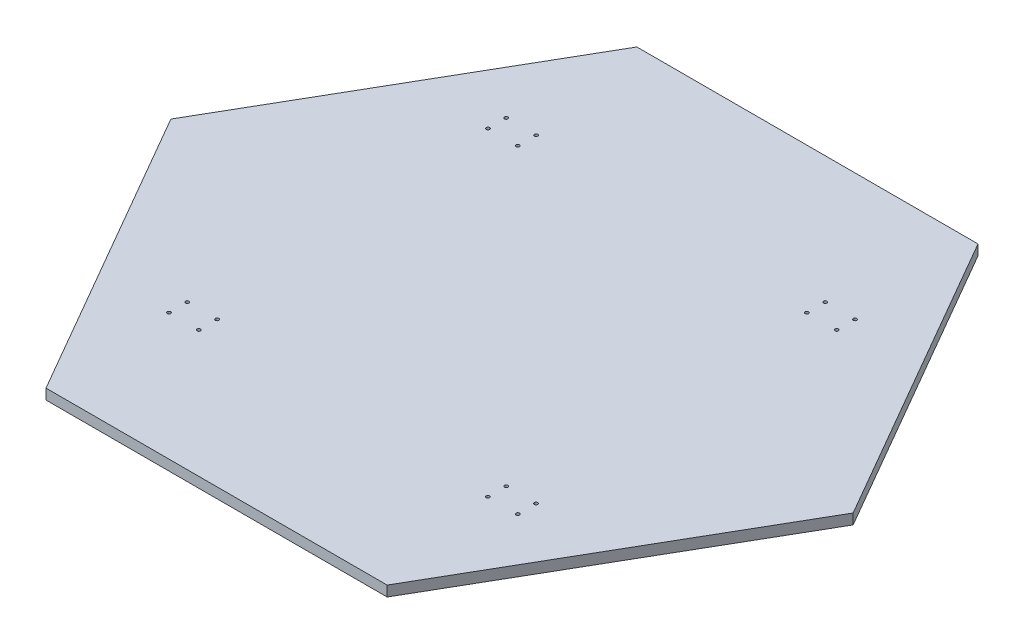
from build123d import *

# Parameters (mm, degrees)
BOSS_EXTRUDE1_DEPTH = 25.4
SKETCH5_R           = 4.191
CUT_EXTRUDE1_DEPTH  = 25.4


with BuildPart() as part:
    # Sketch1 → Boss-Extrude1 (new body)
    with BuildSketch(Plane(origin=(0, 0, 0), x_dir=(1, 0, 0), z_dir=(0, 1, 0))):
        Polygon((835.323484187, 0), (417.661742094, 723.411357684), (-417.661742094, 723.411357684), (-835.323484187, 0), (-417.661742094, -723.411357684), (417.661742094, -723.411357684), align=None)
    extrude(amount=BOSS_EXTRUDE1_DEPTH)

    # Sketch5 → Cut-Extrude1 (cut)
    with BuildSketch(Plane(origin=(0, 25.4, 0), x_dir=(1, 0, 0), z_dir=(0, 1, 0))):
        with Locations(Location((-353.949, 412.877, 0), (0, 0, 270))):
            Circle(SKETCH5_R)
        with Locations(Location((-427.101, 412.877, 0), (0, 0, 270))):
            Circle(SKETCH5_R)
        with Locations(Location((-427.101, 368.173, 0), (0, 0, 270))):
            Circle(SKETCH5_R)
        with Locations(Location((-353.949, 368.173, 0), (0, 0, 270))):
            Circle(SKETCH5_R)
        with Locations(Location((353.949, 368.173, 0), (0, 0, 270))):
            Circle(SKETCH5_R)
        with Locations(Location((427.101, 368.173, 0), (0, 0, 270))):
            Circle(SKETCH5_R)
        with Locations(Location((427.101, 412.877, 0), (0, 0, 270))):
            Circle(SKETCH5_R)
        with Locations(Location((353.949, 412.877, 0), (0, 0, 270))):
            Circle(SKETCH5_R)
        with Locations(Location((353.949, -412.877, 0), (0, 0, 270))):
            Circle(SKETCH5_R)
        with Locations(Location((427.101, -412.877, 0), (0, 0, 270))):
            Circle(SKETCH5_R)
        with Locations(Location((427.101, -368.173, 0), (0, 0, 270))):
            Circle(SKETCH5_R)
        with Locations(Location((353.949, -368.173, 0), (0, 0, 270))):
            Circle(SKETCH5_R)
        with Locations(Location((-353.949, -368.173, 0), (0, 0, 270))):
            Circle(SKETCH5_R)
        with Locations(Location((-427.101, -368.173, 0), (0, 0, 270))):
            Circle(SKETCH5_R)
        with Locations(Location((-427.101, -412.877, 0), (0, 0, 270))):
            Circle(SKETCH5_R)
        with Locations(Location((-353.949, -412.877, 0), (0, 0, 270))):
            Circle(SKETCH5_R)
    extrude(amount=-CUT_EXTRUDE1_DEPTH, mode=Mode.SUBTRACT)


solid = part.part
